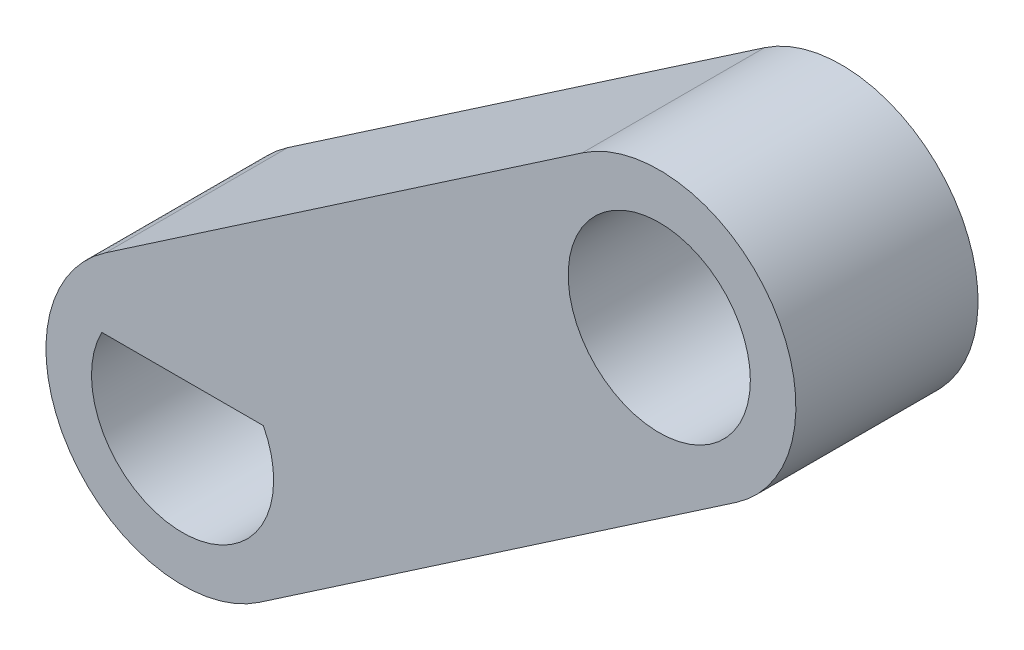
from build123d import *

# Parameters (mm, degrees)
SKETCH_1_R      = 10
EXTRUDE_1_DEPTH = 20


with BuildPart() as part:
    # 草图1 → 凸台-拉伸1 (new body)
    with BuildSketch(Plane.XY.offset(-35.913663537)):
        with BuildLine():
            Line((-92.03956228, 673.590403503), (-39.698813198, 709.260436791))
            ThreePointArc((-39.698813198, 709.260436791), (-18.856217474, 705.312500182), (-22.804154083, 684.469904458))
            Line((-22.804154083, 684.469904458), (-75.144903165, 648.799871169))
            ThreePointArc((-75.144903165, 648.799871169), (-95.98749889, 652.747807779), (-92.03956228, 673.590403503))
        make_face()
        with Locations((-31.251483641, 696.865170625)):
            Circle(SKETCH_1_R, mode=Mode.SUBTRACT)
        with BuildLine():
            Line((-74.722353088, 665.813062766), (-92.462112357, 665.813062766))
            ThreePointArc((-92.462112357, 665.813062766), (-83.592232723, 651.195137336), (-74.722353088, 665.813062766))
        make_face(mode=Mode.SUBTRACT)
    extrude(amount=EXTRUDE_1_DEPTH)


solid = part.part
